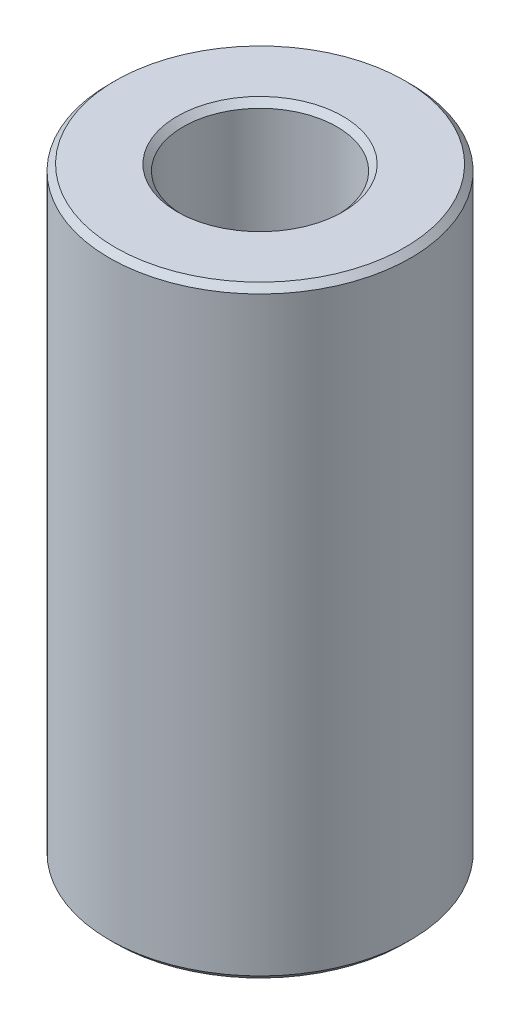
from build123d import *


with BuildPart() as part:
    # Sketch1 → Revolve1 (revolve)
    with BuildSketch(Plane(origin=(0, 0, 0), x_dir=(0, 0, -1), z_dir=(1, 0, 0)), mode=Mode.PRIVATE) as revolve1_sk:
        Polygon((2.55, 9.8), (2.75, 10), (4.8, 10), (5, 9.8), (5, -9.8), (4.8, -10), (2.75, -10), (2.55, -9.8), align=None)
    revolve(revolve1_sk.sketch.rotate(Axis((0, 2.133870968, 0), (0, -1, 0)), 180), axis=Axis((0, 2.133870968, 0), (0, -1, 0)))


solid = part.part
